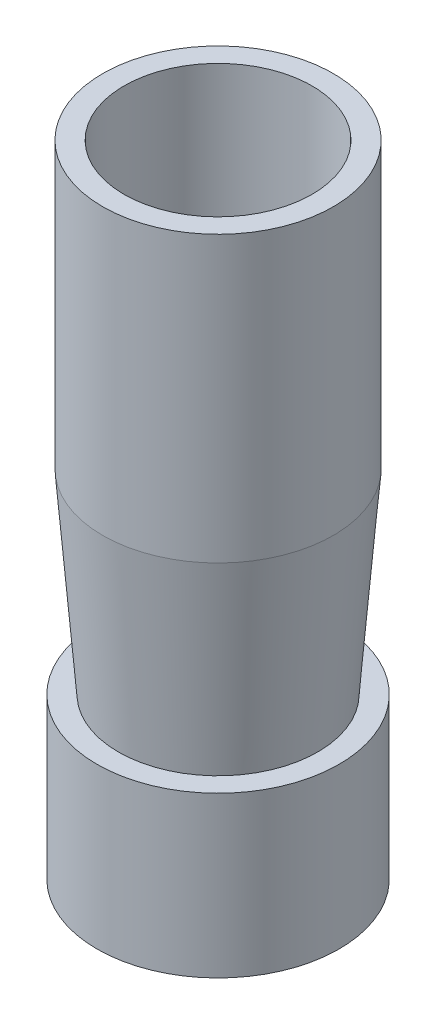
from build123d import *


with BuildPart() as part:
    # Sketch1 → Revolve1 (revolve)
    with BuildSketch(Plane.XY, mode=Mode.PRIVATE) as revolve1_sk:
        Polygon((-23.61209695, 23.102959746), (-23.61209695, 16.326317755), (-23.434661148, 14.104443754), (-21.738699739, -7.132603681), (-21.738699739, -16.987325897), (-26.149594923, -16.987325897), (-26.149594923, -1.987321203), (-24.149594923, -1.987321203), (-25.61209695, 16.326317755), (-25.61209695, 26.326317755), (-25.61209695, 43.016317755), (-23.61209695, 43.016317755), (-23.61209695, 26.326317755), (-17.54709695, -12.35124314), (-17.79709695, -12.552042736), align=None)
    revolve(revolve1_sk.sketch.rotate(Axis((-14.79709695, 26.42483871, 0), (0, -1, 0)), 270), axis=Axis((-14.79709695, 26.42483871, 0), (0, -1, 0)))


solid = part.part
